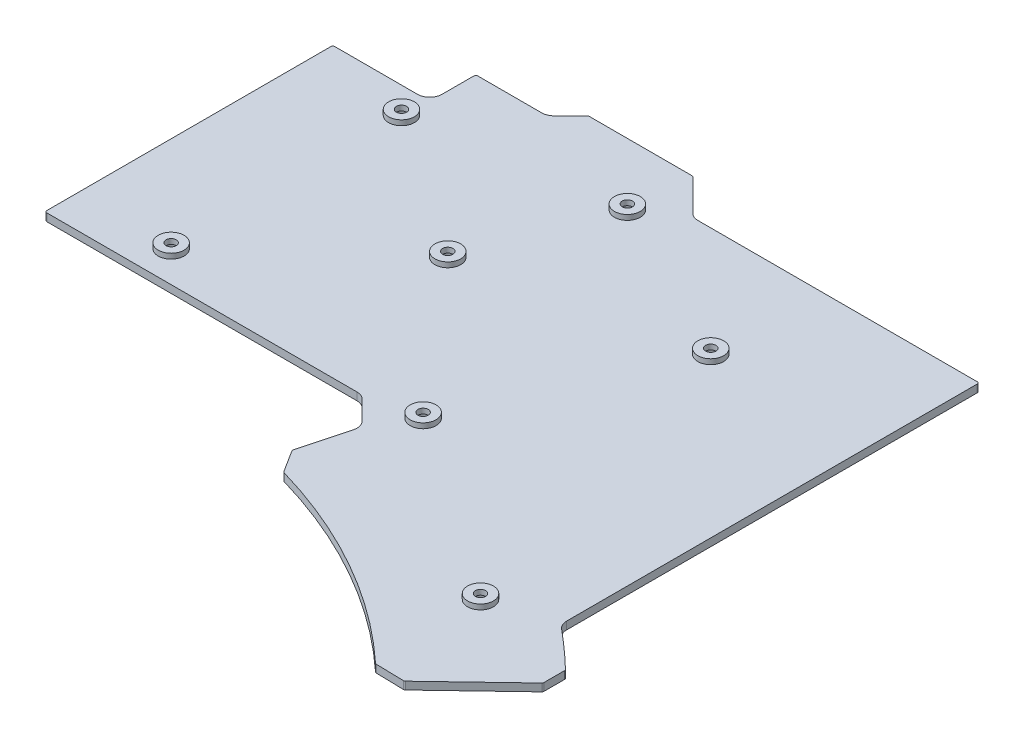
from build123d import *

# Parameters (mm, degrees)
SCHIZZO1_R                     = 2.525
SCHIZZO1_R_2                   = 0.6
ESTRUSIONE_ESTRUSIONE1_DEPTH   = 1
ESTRUSIONE_ESTRUSIONE1_2_DEPTH = 1
ESTRUSIONE_ESTRUSIONE1_3_DEPTH = 1
ESTRUSIONE_ESTRUSIONE1_4_DEPTH = 1
ESTRUSIONE_ESTRUSIONE1_5_DEPTH = 1
ESTRUSIONE_ESTRUSIONE1_6_DEPTH = 1
ESTRUSIONE_ESTRUSIONE1_7_DEPTH = 1
SCHIZZO1_4_R                   = 0.6
ESTRUSIONE_ESTRUSIONE3_DEPTH   = 1.5
SCHIZZO2_R                     = 1
SCHIZZO2_R_2                   = 0.6
TAGLIO_ESTRUSIONE1_DEPTH       = 206.778654361
SCHIZZO2_3_R                   = 2.1
TAGLIO_ESTRUSIONE2_DEPTH       = 1.5
TAGLIO_ESTRUSIONE3_DEPTH       = 206.778654361
RACCORDO1_R                    = 0.4


with BuildPart() as part:
    # Schizzo1 → Estrusione-Estrusione1 (new body)
    with BuildSketch(Plane.XZ.offset(-9.997150898)):
        with Locations(Location((-8.400568352, 142.795613421, 0), (0, 0, 270))):
            Circle(SCHIZZO1_R)
        with Locations(Location((-8.400568352, 142.795613421, 0), (0, 0, 270))):
            Circle(SCHIZZO1_R_2, mode=Mode.SUBTRACT)
    extrude(amount=-ESTRUSIONE_ESTRUSIONE1_DEPTH)


with BuildPart() as body_2:
    # Schizzo1 → Estrusione-Estrusione1 2 (new body)
    with BuildSketch(Plane.XZ.offset(-9.997150898)):
        with Locations(Location((-33.235959006, 113.134868204, 0), (0, 0, 270))):
            Circle(SCHIZZO1_R)
        with Locations(Location((-33.235959006, 113.134868204, 0), (0, 0, 270))):
            Circle(SCHIZZO1_R_2, mode=Mode.SUBTRACT)
    extrude(amount=-ESTRUSIONE_ESTRUSIONE1_2_DEPTH)


with BuildPart() as body_3:
    # Schizzo1 → Estrusione-Estrusione1 3 (new body)
    with BuildSketch(Plane.XZ.offset(-9.997150898)):
        with Locations(Location((-61.810959006, 93.609868204, 0), (0, 0, 270))):
            Circle(SCHIZZO1_R)
        with Locations(Location((-61.810959006, 93.609868204, 0), (0, 0, 270))):
            Circle(SCHIZZO1_R_2, mode=Mode.SUBTRACT)
    extrude(amount=-ESTRUSIONE_ESTRUSIONE1_3_DEPTH)


with BuildPart() as body_4:
    # Schizzo1 → Estrusione-Estrusione1 4 (new body)
    with BuildSketch(Plane.XZ.offset(-9.997150898)):
        with Locations(Location((-23.710959006, 87.559868204, 0), (0, 0, 270))):
            Circle(SCHIZZO1_R)
        with Locations(Location((-23.710959006, 87.559868204, 0), (0, 0, 270))):
            Circle(SCHIZZO1_R_2, mode=Mode.SUBTRACT)
    extrude(amount=-ESTRUSIONE_ESTRUSIONE1_4_DEPTH)


with BuildPart() as body_5:
    # Schizzo1 → Estrusione-Estrusione1 5 (new body)
    with BuildSketch(Plane.XZ.offset(-9.997150898)):
        with Locations(Location((8.864040994, 103.834868204, 0), (0, 0, 270))):
            Circle(SCHIZZO1_R)
        with Locations(Location((8.864040994, 103.834868204, 0), (0, 0, 270))):
            Circle(SCHIZZO1_R_2, mode=Mode.SUBTRACT)
    extrude(amount=-ESTRUSIONE_ESTRUSIONE1_5_DEPTH)


with BuildPart() as body_6:
    # Schizzo1 → Estrusione-Estrusione1 6 (new body)
    with BuildSketch(Plane.XZ.offset(-9.997150898)):
        with Locations(Location((-61.735959006, 138.709868204, 0), (0, 0, 270))):
            Circle(SCHIZZO1_R)
        with Locations(Location((-61.735959006, 138.709868204, 0), (0, 0, 270))):
            Circle(SCHIZZO1_R_2, mode=Mode.SUBTRACT)
    extrude(amount=-ESTRUSIONE_ESTRUSIONE1_6_DEPTH)


with BuildPart() as body_7:
    # Schizzo1 → Estrusione-Estrusione1 7 (new body)
    with BuildSketch(Plane.XZ.offset(-9.997150898)):
        with Locations(Location((27.877840097, 167.853001817, 0), (0, 0, 270))):
            Circle(SCHIZZO1_R)
        with Locations(Location((27.877840097, 167.853001817, 0), (0, 0, 270))):
            Circle(SCHIZZO1_R_2, mode=Mode.SUBTRACT)
    extrude(amount=-ESTRUSIONE_ESTRUSIONE1_7_DEPTH)


with BuildPart() as body_8:
    # Schizzo1<4> → Estrusione-Estrusione3 (new body)
    with BuildSketch(Plane.XZ.offset(-9.997150898)):
        with BuildLine():
            Line((-61.585959006, 85.109868204), (-61.585959006, 79.309868204))
            Line((-61.585959006, 79.309868204), (-48.90727935, 79.309868204))
            ThreePointArc((-48.90727935, 79.309868204), (-47.682692366, 79.066282708), (-46.64453765, 78.372609904))
            Line((-46.64453765, 78.372609904), (-43.53179595, 75.259868204))
            Line((-43.53179595, 75.259868204), (-22.940122062, 75.259868204))
            Line((-22.940122062, 75.259868204), (-16.877380362, 81.322609904))
            ThreePointArc((-16.877380362, 81.322609904), (-15.839225646, 82.016282708), (-14.614638663, 82.259868204))
            Line((-14.614638663, 82.259868204), (40.164040994, 82.259868204))
            Line((40.164040994, 82.259868204), (40.164040994, 162.640274386))
            ThreePointArc((40.164040994, 162.640274386), (40.465028695, 163.995164674), (41.311370802, 165.095176642))
            ThreePointArc((41.311370802, 165.095176642), (44.888982085, 168.200611029), (48.349507568, 171.436007235))
            Line((48.349507568, 171.436007235), (48.349507568, 175.99150674))
            Line((48.349507568, 175.99150674), (34.341569111, 189.34773275))
            Line((34.341569111, 189.34773275), (28.440404626, 189.207188998))
            ThreePointArc((28.440404626, 189.207188998), (9.103555092, 175.013003825), (-13.019946896, 165.742658503))
            Line((-13.019946896, 165.742658503), (-16.007281898, 161.026067764))
            Line((-16.007281898, 161.026067764), (-13.602724619, 152.052137829))
            ThreePointArc((-13.602724619, 152.052137829), (-13.602724619, 150.39569594), (-14.430945563, 148.961175185))
            Line((-14.430945563, 148.961175185), (-17.444994244, 145.947126504))
            ThreePointArc((-17.444994244, 145.947126504), (-18.48314896, 145.2534537), (-19.707735944, 145.009868204))
            Line((-19.707735944, 145.009868204), (-80.535959006, 145.009868204))
            Line((-80.535959006, 145.009868204), (-80.535959006, 88.309868204))
            Line((-80.535959006, 88.309868204), (-64.785959006, 88.309868204))
            ThreePointArc((-64.785959006, 88.309868204), (-62.523217306, 87.372609904), (-61.585959006, 85.109868204))
        make_face()
        with Locations(Location((-23.710959006, 87.559868204, 0), (0, 0, 90))):
            Circle(SCHIZZO1_4_R, mode=Mode.SUBTRACT)
        with Locations(Location((-33.235959006, 113.134868204, 0), (0, 0, 90))):
            Circle(SCHIZZO1_4_R, mode=Mode.SUBTRACT)
        with Locations(Location((8.864040994, 103.834868204, 0), (0, 0, 90))):
            Circle(SCHIZZO1_4_R, mode=Mode.SUBTRACT)
        with Locations(Location((27.877840097, 167.853001817, 0), (0, 0, 90))):
            Circle(SCHIZZO1_4_R, mode=Mode.SUBTRACT)
        with Locations(Location((-61.810959006, 93.609868204, 0), (0, 0, 90))):
            Circle(SCHIZZO1_4_R, mode=Mode.SUBTRACT)
        with Locations(Location((-61.735959006, 138.709868204, 0), (0, 0, 90))):
            Circle(SCHIZZO1_4_R, mode=Mode.SUBTRACT)
        with Locations(Location((-8.400568352, 142.795613421, 0), (0, 0, 90))):
            Circle(SCHIZZO1_4_R, mode=Mode.SUBTRACT)
    extrude(amount=ESTRUSIONE_ESTRUSIONE3_DEPTH)

    # Schizzo2<3> → Taglio-Estrusione2 (cut)
    with BuildSketch(Plane.XZ.offset(-8.497150898)):
        with Locations(Location((-61.735959006, 138.709868204, 0), (0, 0, 270))):
            Circle(SCHIZZO2_3_R)
        with Locations(Location((-8.400568352, 142.795613421, 0), (0, 0, 270))):
            Circle(SCHIZZO2_3_R)
        with Locations(Location((27.877840097, 167.853001817, 0), (0, 0, 270))):
            Circle(SCHIZZO2_3_R)
        with Locations(Location((8.864040994, 103.834868204, 0), (0, 0, 270))):
            Circle(SCHIZZO2_3_R)
        with Locations(Location((-23.710959006, 87.559868204, 0), (0, 0, 270))):
            Circle(SCHIZZO2_3_R)
        with Locations(Location((-61.810959006, 93.609868204, 0), (0, 0, 270))):
            Circle(SCHIZZO2_3_R)
        with Locations(Location((-33.235959006, 113.134868204, 0), (0, 0, 270))):
            Circle(SCHIZZO2_3_R)
    extrude(amount=-TAGLIO_ESTRUSIONE2_DEPTH, mode=Mode.SUBTRACT)

    # Schizzo3 → Taglio-Estrusione3 (cut, through all)
    # profile 1 of 7: a face of its own
    with BuildSketch(Plane.XZ.offset(-8.497150898)):
        with BuildLine():
            ThreePointArc((-17.444994244, 145.947126504), (-18.48314896, 145.2534537), (-19.707735944, 145.009868204))
            Line((-19.707735944, 145.009868204), (-80.535959006, 145.009868204))
            Line((-80.535959006, 145.009868204), (-80.535959006, 88.309868204))
            Line((-80.535959006, 88.309868204), (-64.785959006, 88.309868204))
            ThreePointArc((-64.785959006, 88.309868204), (-62.523217306, 87.372609904), (-61.585959006, 85.109868204))
            Line((-61.585959006, 85.109868204), (-61.585959006, 79.309868204))
            Line((-61.585959006, 79.309868204), (-48.90727935, 79.309868204))
            ThreePointArc((-48.90727935, 79.309868204), (-47.682692366, 79.066282708), (-46.64453765, 78.372609904))
            Line((-46.64453765, 78.372609904), (-43.53179595, 75.259868204))
            Line((-43.53179595, 75.259868204), (-22.940122062, 75.259868204))
            Line((-22.940122062, 75.259868204), (-16.877380362, 81.322609904))
            ThreePointArc((-16.877380362, 81.322609904), (-15.839225646, 82.016282708), (-14.614638663, 82.259868204))
            Line((-14.614638663, 82.259868204), (40.164040994, 82.259868204))
            Line((40.164040994, 82.259868204), (40.164040994, 162.640274386))
            ThreePointArc((40.164040994, 162.640274386), (40.465028695, 163.995164674), (41.311370802, 165.095176642))
            ThreePointArc((41.311370802, 165.095176642), (44.888982085, 168.200611029), (48.349507568, 171.436007235))
            Line((48.349507568, 171.436007235), (48.349507568, 175.99150674))
            Line((48.349507568, 175.99150674), (34.341569111, 189.34773275))
            Line((34.341569111, 189.34773275), (28.440404626, 189.207188998))
            ThreePointArc((28.440404626, 189.207188998), (9.103555092, 175.013003825), (-13.019946896, 165.742658503))
            Line((-13.019946896, 165.742658503), (-16.007281898, 161.026067764))
            Line((-16.007281898, 161.026067764), (-13.602724619, 152.052137829))
            ThreePointArc((-13.602724619, 152.052137829), (-13.602724619, 150.39569594), (-14.430945563, 148.961175185))
            Line((-14.430945563, 148.961175185), (-17.444994244, 145.947126504))
        make_face()
        with BuildLine():
            Line((-80.335959006, 144.809868204), (-19.707735944, 144.809868204))
            ThreePointArc((-19.707735944, 144.809868204), (-18.406612274, 145.068677793), (-17.303572888, 145.805705148))
            Line((-17.303572888, 145.805705148), (-14.289524207, 148.819753829))
            ThreePointArc((-14.289524207, 148.819753829), (-13.409539454, 150.343932131), (-13.409539454, 152.103901638))
            Line((-13.409539454, 152.103901638), (-15.791401568, 160.993132066))
            Line((-15.791401568, 160.993132066), (-12.891708807, 165.571347771))
            ThreePointArc((-12.891708807, 165.571347771), (9.202063312, 174.838945988), (28.521252605, 189.009057782))
            Line((28.521252605, 189.009057782), (34.263511788, 189.145817002))
            Line((34.263511788, 189.145817002), (48.149507568, 175.905860346))
            Line((48.149507568, 175.905860346), (48.149507568, 171.520668938))
            ThreePointArc((48.149507568, 171.520668938), (44.723683288, 168.320894897), (41.183078915, 165.248608032))
            ThreePointArc((41.183078915, 165.248608032), (40.283840427, 164.079845317), (39.964040994, 162.640274386))
            Line((39.964040994, 162.640274386), (39.964040994, 82.459868204))
            Line((39.964040994, 82.459868204), (-14.614638663, 82.459868204))
            ThreePointArc((-14.614638663, 82.459868204), (-15.915762333, 82.201058615), (-17.018801719, 81.46403126))
            Line((-17.018801719, 81.46403126), (-23.022964775, 75.459868204))
            Line((-23.022964775, 75.459868204), (-43.448953238, 75.459868204))
            Line((-43.448953238, 75.459868204), (-46.503116294, 78.51403126))
            ThreePointArc((-46.503116294, 78.51403126), (-47.60615568, 79.251058615), (-48.90727935, 79.509868204))
            Line((-48.90727935, 79.509868204), (-61.385959006, 79.509868204))
            Line((-61.385959006, 79.509868204), (-61.385959006, 85.109868204))
            ThreePointArc((-61.385959006, 85.109868204), (-62.38179595, 87.51403126), (-64.785959006, 88.509868204))
            Line((-64.785959006, 88.509868204), (-80.335959006, 88.509868204))
            Line((-80.335959006, 88.509868204), (-80.335959006, 144.809868204))
        make_face(mode=Mode.SUBTRACT)
    # profile 2 of 7: a face of its own
    with BuildSketch(Plane.XZ.offset(-8.497150898)):
        with BuildLine():
            ThreePointArc((39.964040994, 162.640274386), (40.283840427, 164.079845317), (41.183078915, 165.248608032))
            ThreePointArc((41.183078915, 165.248608032), (41.007236623, 165.101844148), (40.831132199, 164.955394902))
            ThreePointArc((40.831132199, 164.955394902), (40.191602145, 164.128778405), (39.964040994, 163.108724757))
            Line((39.964040994, 163.108724757), (39.964040994, 162.640274386))
        make_face()
    # profile 3 of 7: a face of its own
    with BuildSketch(Plane.XZ.offset(-8.497150898)):
        with BuildLine():
            ThreePointArc((-13.409539454, 152.103901638), (-13.409539454, 150.343932131), (-14.289524207, 148.819753829))
            Line((-14.289524207, 148.819753829), (-13.881275916, 149.228002119))
            ThreePointArc((-13.881275916, 149.228002119), (-13.260110208, 150.303892686), (-13.260110208, 151.546224102))
            Line((-13.260110208, 151.546224102), (-13.409539454, 152.103901638))
        make_face()
    # profile 4 of 7: a face of its own
    with BuildSketch(Plane.XZ.offset(-8.497150898)):
        with BuildLine():
            ThreePointArc((-17.303572888, 145.805705148), (-18.406612274, 145.068677793), (-19.707735944, 144.809868204))
            Line((-19.707735944, 144.809868204), (-19.293522381, 144.809868204))
            ThreePointArc((-19.293522381, 144.809868204), (-18.375082144, 144.992557326), (-17.596466106, 145.512811929))
            Line((-17.596466106, 145.512811929), (-17.303572888, 145.805705148))
        make_face()
    # profile 5 of 7: a face of its own
    with BuildSketch(Plane.XZ.offset(-8.497150898)):
        with BuildLine():
            Line((-63.785959006, 88.509868204), (-64.785959006, 88.509868204))
            ThreePointArc((-64.785959006, 88.509868204), (-62.38179595, 87.51403126), (-61.385959006, 85.109868204))
            Line((-61.385959006, 85.109868204), (-61.385959006, 86.109868204))
            ThreePointArc((-61.385959006, 86.109868204), (-62.088902731, 87.806924479), (-63.785959006, 88.509868204))
        make_face()
    # profile 6 of 7: a face of its own
    with BuildSketch(Plane.XZ.offset(-8.497150898)):
        with BuildLine():
            Line((-48.493065787, 79.509868204), (-48.90727935, 79.509868204))
            ThreePointArc((-48.90727935, 79.509868204), (-47.60615568, 79.251058615), (-46.503116294, 78.51403126))
            Line((-46.503116294, 78.51403126), (-46.796009512, 78.806924479))
            ThreePointArc((-46.796009512, 78.806924479), (-47.57462555, 79.327179082), (-48.493065787, 79.509868204))
        make_face()
    # profile 7 of 7: a face of its own
    with BuildSketch(Plane.XZ.offset(-8.497150898)):
        with BuildLine():
            Line((-16.7259085, 81.756924479), (-17.018801719, 81.46403126))
            ThreePointArc((-17.018801719, 81.46403126), (-15.915762333, 82.201058615), (-14.614638663, 82.459868204))
            Line((-14.614638663, 82.459868204), (-15.028852225, 82.459868204))
            ThreePointArc((-15.028852225, 82.459868204), (-15.947292463, 82.277179082), (-16.7259085, 81.756924479))
        make_face()
    extrude(amount=-TAGLIO_ESTRUSIONE3_DEPTH, mode=Mode.SUBTRACT)

    # Raccordo1
    raccordo1_edges = [body_8.edges().sort_by_distance(p)[0] for p in [
        (-80.335959006, 9.247150898, 144.809868204),
        (-80.335959006, 9.247150898, 88.509868204),
        (-61.385959006, 9.247150898, 79.509868204),
        (-43.448953238, 9.247150898, 75.459868204),
        (-23.022964775, 9.247150898, 75.459868204),
        (39.964040994, 9.247150898, 82.459868204),
        (48.149507568, 9.247150898, 171.520668938),
        (48.149507568, 9.247150898, 175.905860346),
        (34.263511788, 9.247150898, 189.145817002),
        (28.521252605, 9.247150898, 189.009057782),
        (-12.891708807, 9.247150898, 165.571347771),
        (-15.791401568, 9.247150898, 160.993132066),
    ]]
    fillet(raccordo1_edges, radius=RACCORDO1_R)


with BuildPart() as taglio_estrusione1_tool:
    # Schizzo2 → Taglio-Estrusione1 (new, through all)
    # profile 1 of 7: a face of its own
    with BuildSketch(Plane.XZ.offset(-8.497150898)):
        with Locations(Location((-61.735959006, 138.709868204, 0), (0, 0, 270))):
            Circle(SCHIZZO2_R)
        with Locations(Location((-61.735959006, 138.709868204, 0), (0, 0, 90))):
            Circle(SCHIZZO2_R_2, mode=Mode.SUBTRACT)
    # profile 2 of 7: a face of its own
    with BuildSketch(Plane.XZ.offset(-8.497150898)):
        with Locations(Location((-8.400568352, 142.795613421, 0), (0, 0, 270))):
            Circle(SCHIZZO2_R)
        with Locations(Location((-8.400568352, 142.795613421, 0), (0, 0, 90))):
            Circle(SCHIZZO2_R_2, mode=Mode.SUBTRACT)
    # profile 3 of 7: a face of its own
    with BuildSketch(Plane.XZ.offset(-8.497150898)):
        with Locations(Location((-33.235959006, 113.134868204, 0), (0, 0, 270))):
            Circle(SCHIZZO2_R)
        with Locations(Location((-33.235959006, 113.134868204, 0), (0, 0, 90))):
            Circle(SCHIZZO2_R_2, mode=Mode.SUBTRACT)
    # profile 4 of 7: a face of its own
    with BuildSketch(Plane.XZ.offset(-8.497150898)):
        with Locations(Location((-61.810959006, 93.609868204, 0), (0, 0, 270))):
            Circle(SCHIZZO2_R)
        with Locations(Location((-61.810959006, 93.609868204, 0), (0, 0, 90))):
            Circle(SCHIZZO2_R_2, mode=Mode.SUBTRACT)
    # profile 5 of 7: a face of its own
    with BuildSketch(Plane.XZ.offset(-8.497150898)):
        with Locations(Location((-23.710959006, 87.559868204, 0), (0, 0, 270))):
            Circle(SCHIZZO2_R)
        with Locations(Location((-23.710959006, 87.559868204, 0), (0, 0, 90))):
            Circle(SCHIZZO2_R_2, mode=Mode.SUBTRACT)
    # profile 6 of 7: a face of its own
    with BuildSketch(Plane.XZ.offset(-8.497150898)):
        with Locations(Location((8.864040994, 103.834868204, 0), (0, 0, 270))):
            Circle(SCHIZZO2_R)
        with Locations(Location((8.864040994, 103.834868204, 0), (0, 0, 90))):
            Circle(SCHIZZO2_R_2, mode=Mode.SUBTRACT)
    # profile 7 of 7: a face of its own
    with BuildSketch(Plane.XZ.offset(-8.497150898)):
        with Locations(Location((27.877840097, 167.853001817, 0), (0, 0, 270))):
            Circle(SCHIZZO2_R)
        with Locations(Location((27.877840097, 167.853001817, 0), (0, 0, 90))):
            Circle(SCHIZZO2_R_2, mode=Mode.SUBTRACT)
    extrude(amount=-TAGLIO_ESTRUSIONE1_DEPTH)


with BuildPart() as part_1:
    add(part.part)

    # Taglio-Estrusione1: cut by taglio_estrusione1_tool
    add(taglio_estrusione1_tool.part, mode=Mode.SUBTRACT)


with BuildPart() as body_2_1:
    add(body_2.part)

    # Taglio-Estrusione1: cut by taglio_estrusione1_tool
    add(taglio_estrusione1_tool.part, mode=Mode.SUBTRACT)


with BuildPart() as body_3_1:
    add(body_3.part)

    # Taglio-Estrusione1: cut by taglio_estrusione1_tool
    add(taglio_estrusione1_tool.part, mode=Mode.SUBTRACT)


with BuildPart() as body_4_1:
    add(body_4.part)

    # Taglio-Estrusione1: cut by taglio_estrusione1_tool
    add(taglio_estrusione1_tool.part, mode=Mode.SUBTRACT)


with BuildPart() as body_5_1:
    add(body_5.part)

    # Taglio-Estrusione1: cut by taglio_estrusione1_tool
    add(taglio_estrusione1_tool.part, mode=Mode.SUBTRACT)


with BuildPart() as body_6_1:
    add(body_6.part)

    # Taglio-Estrusione1: cut by taglio_estrusione1_tool
    add(taglio_estrusione1_tool.part, mode=Mode.SUBTRACT)


with BuildPart() as body_7_1:
    add(body_7.part)

    # Taglio-Estrusione1: cut by taglio_estrusione1_tool
    add(taglio_estrusione1_tool.part, mode=Mode.SUBTRACT)


solid = Compound([body_8.part, part_1.part, body_2_1.part, body_3_1.part, body_4_1.part, body_5_1.part, body_6_1.part, body_7_1.part])
